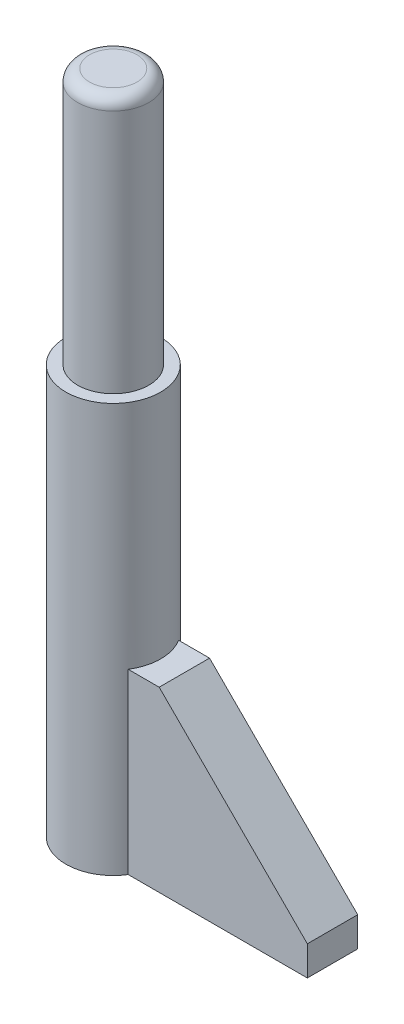
from build123d import *

# Parameters (mm, degrees)
SKETCH1_R           = 2.032
BOSS_EXTRUDE1_DEPTH = 17.526
SKETCH2_W           = 9.398
SKETCH2_H           = 2.159
BOSS_EXTRUDE2_DEPTH = 7.62
CHAMFER1_SIZE       = 6.35
SKETCH3_R           = 1.524
BOSS_EXTRUDE3_DEPTH = 11
FILLET1_R           = 0.508


with BuildPart() as part:
    # Sketch1 → Boss-Extrude1 (new body)
    with BuildSketch(Plane(origin=(0, 0, 0), x_dir=(1, 0, 0), z_dir=(0, 1, 0))):
        with Locations(Location((0, 0, 0), (0, 0, 270))):
            Circle(SKETCH1_R)
    extrude(amount=BOSS_EXTRUDE1_DEPTH)

    # Sketch2 → Boss-Extrude2 (add)
    with BuildSketch(Plane.XZ):
        with Locations((4.699, 0)):
            Rectangle(SKETCH2_W, SKETCH2_H)
    extrude(amount=-BOSS_EXTRUDE2_DEPTH)

    # Chamfer1
    chamfer1_edges = [part.edges().sort_by_distance(p)[0] for p in [
        (9.398, 7.62, 0),
    ]]
    chamfer(chamfer1_edges, length=CHAMFER1_SIZE)

    # Sketch3 → Boss-Extrude3 (add)
    with BuildSketch(Plane(origin=(0, 17.526, 0), x_dir=(1, 0, 0), z_dir=(0, 1, 0))):
        with Locations(Location((0, 0, 0), (0, 0, 270))):
            Circle(SKETCH3_R)
    extrude(amount=BOSS_EXTRUDE3_DEPTH)

    # Fillet1
    fillet1_edges = [part.edges().sort_by_distance(p)[0] for p in [
        (0, 28.526, -1.524),
    ]]
    fillet(fillet1_edges, radius=FILLET1_R)


solid = part.part
